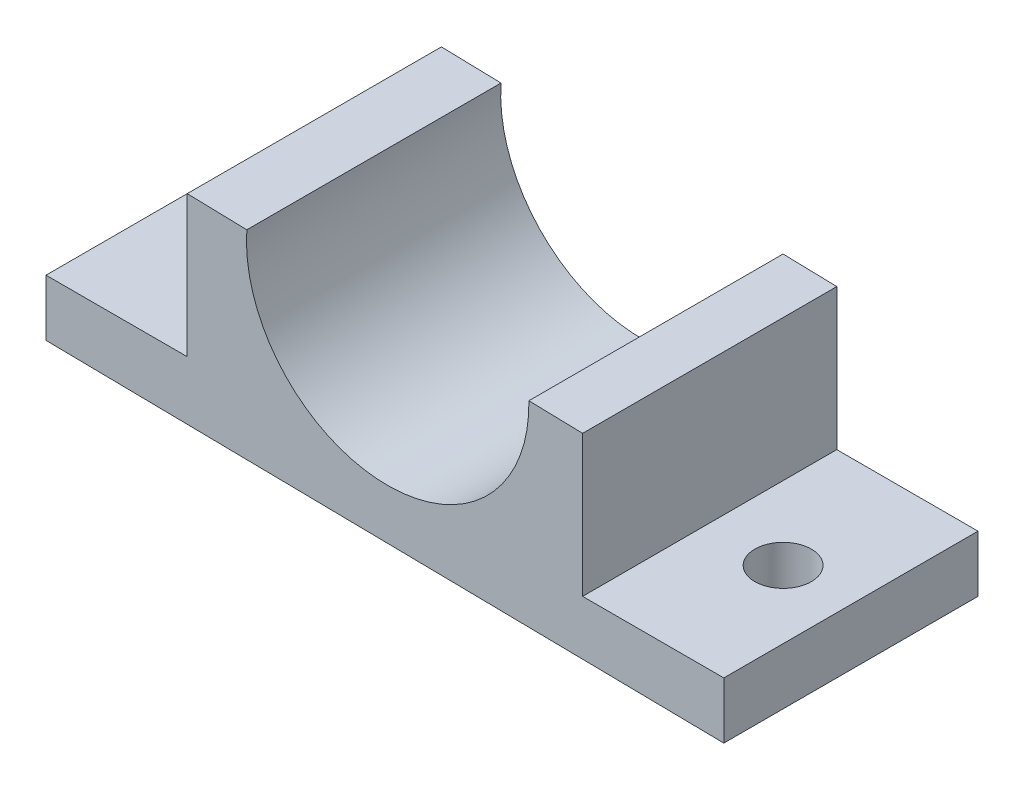
from build123d import *

# Parameters (mm, degrees)
BOSS_EXTRUDE2_DEPTH = 57.15
SKETCH8_R           = 6.35
CUT_EXTRUDE8_DEPTH  = 91.948
SKETCH6_R           = 6.35
CUT_EXTRUDE9_DEPTH  = 91.948


with BuildPart() as part:
    # Sketch1 → Boss-Extrude2 (new body)
    with BuildSketch(Plane.XY):
        with BuildLine():
            Line((-152.4, 2.2186447), (0, 0))
            Line((0, 0), (0, 12.7))
            Line((0, 12.7), (-31.75, 12.7))
            Line((-31.75, 12.7), (-31.75, 44.45))
            Line((-31.75, 44.45), (-43.829743935, 44.75146974))
            ThreePointArc((-43.829743935, 44.75146974), (-43.825200034, 44.441370306), (-43.823685352, 44.131241281))
            ThreePointArc((-43.823685352, 44.131241281), (-76.675806516, 12.400375725), (-107.247170639, 46.334155203))
            Line((-107.247170639, 46.334155203), (-120.65, 46.6686447))
            Line((-120.65, 46.6686447), (-120.65, 14.9186447))
            Line((-120.65, 14.9186447), (-152.4, 14.9186447))
            Line((-152.4, 14.9186447), (-152.4, 2.2186447))
        make_face()
    extrude(amount=BOSS_EXTRUDE2_DEPTH)

    # Sketch8 → Cut-Extrude8 (cut)
    with BuildSketch(Plane(origin=(0, 14.9186447, 0), x_dir=(1, 0, 0), z_dir=(0, 1, 0))):
        with Locations(Location((-135.898685352, -28.575, 0), (0, 0, 270))):
            Circle(SKETCH8_R)
    extrude(amount=-CUT_EXTRUDE8_DEPTH, mode=Mode.SUBTRACT)

    # Sketch6 → Cut-Extrude9 (cut)
    with BuildSketch(Plane(origin=(0, 12.7, 0), x_dir=(1, 0, 0), z_dir=(0, 1, 0))):
        with Locations(Location((-15.248685352, -28.575, 0), (0, 0, 270))):
            Circle(SKETCH6_R)
    extrude(amount=-CUT_EXTRUDE9_DEPTH, mode=Mode.SUBTRACT)


solid = part.part
